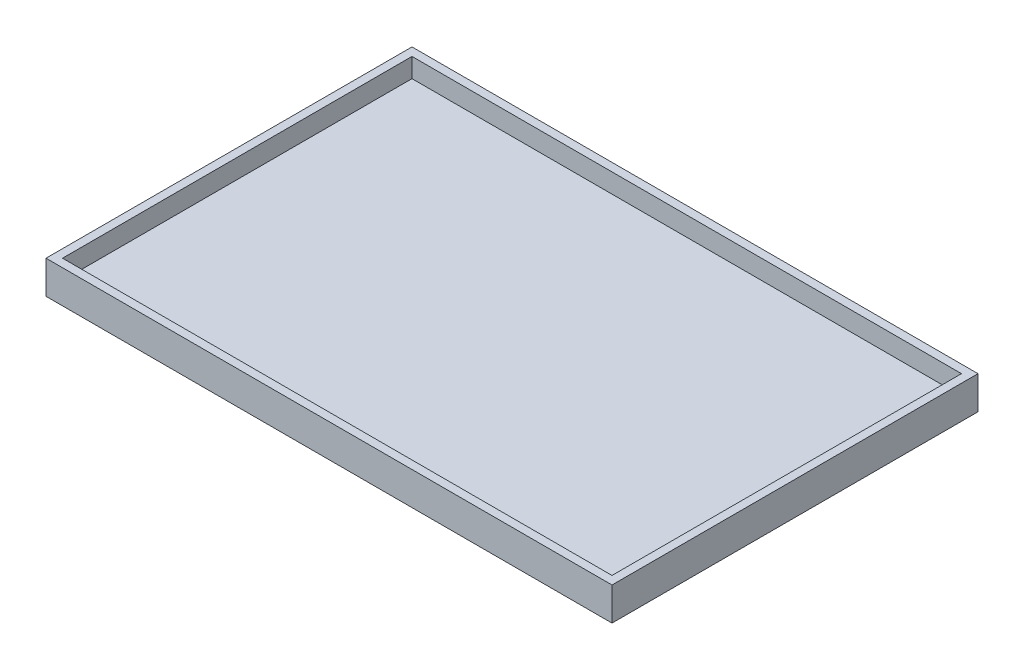
from build123d import *

# Parameters (mm, degrees)
SKETCH1_W                = 98.81
SKETCH1_H                = 62.48
BOSS_EXTRUDE1_DEPTH      = 1.5
BOSS_EXTRUDE2_DEPTH      = 3
BOSS_EXTRUDE2_DEPTH_BACK = 3
SKETCH2_W                = 102.81
SKETCH2_H                = 66.48
SKETCH2_W_2              = 99.81
SKETCH2_H_2              = 63.48


with BuildPart() as part:
    # Sketch1 → Boss-Extrude1 (new body)
    with BuildSketch(Plane(origin=(0, 0, 0), x_dir=(1, 0, 0), z_dir=(0, 1, 0))):
        Rectangle(SKETCH1_W, SKETCH1_H)
    extrude(amount=BOSS_EXTRUDE1_DEPTH)


with BuildPart() as body_2:
    # Sketch2 → Boss-Extrude2 (new, two sides: drawn at the far end of the back side and taken through both)
    with BuildSketch(Plane(origin=(0, 1.5, 0), x_dir=(1, 0, 0), z_dir=(0, 1, 0)).offset(-BOSS_EXTRUDE2_DEPTH_BACK)):
        Rectangle(SKETCH2_W, SKETCH2_H)
        Rectangle(SKETCH2_W_2, SKETCH2_H_2, mode=Mode.SUBTRACT)
    extrude(amount=BOSS_EXTRUDE2_DEPTH + BOSS_EXTRUDE2_DEPTH_BACK)


solid = Compound([part.part, body_2.part])
